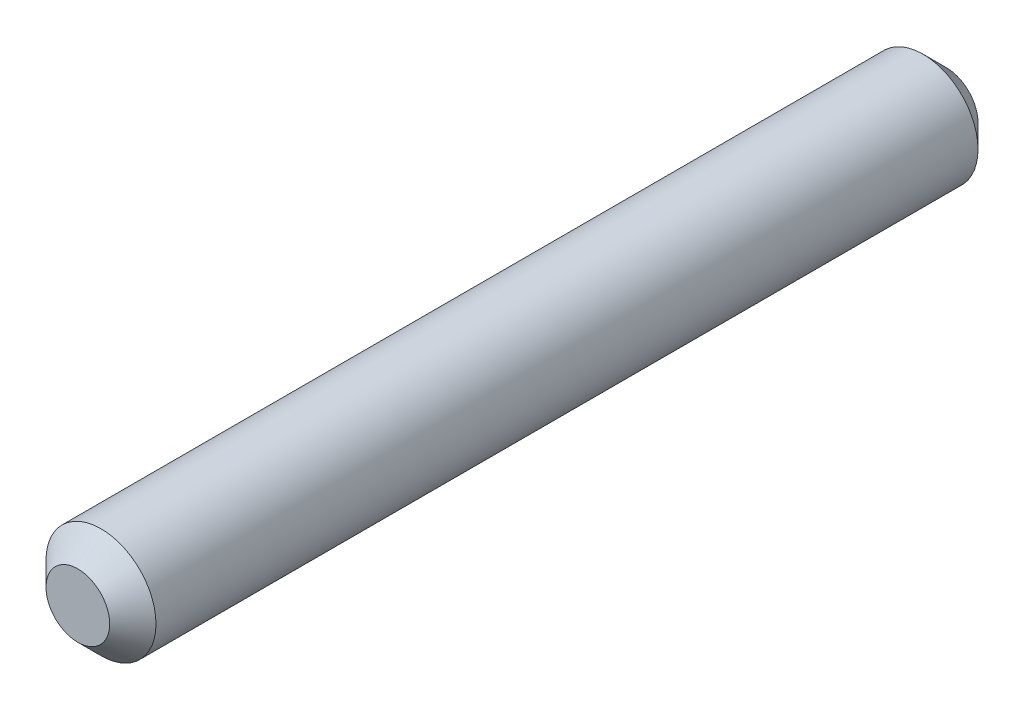
from build123d import *

# Parameters (mm, degrees)
SKETCH1_R           = 4.75
BOSS_EXTRUDE1_DEPTH = 75
CHAMFER1_SIZE       = 2


with BuildPart() as part:
    # Sketch1 → Boss-Extrude1 (new body)
    with BuildSketch(Plane.XY):
        Circle(SKETCH1_R)
    extrude(amount=BOSS_EXTRUDE1_DEPTH)

    # Chamfer1
    chamfer1_edges = [part.edges().sort_by_distance(p)[0] for p in [
        (-4.75, 0, 0),
        (-4.75, 0, 75),
    ]]
    chamfer(chamfer1_edges, length=CHAMFER1_SIZE)


solid = part.part
